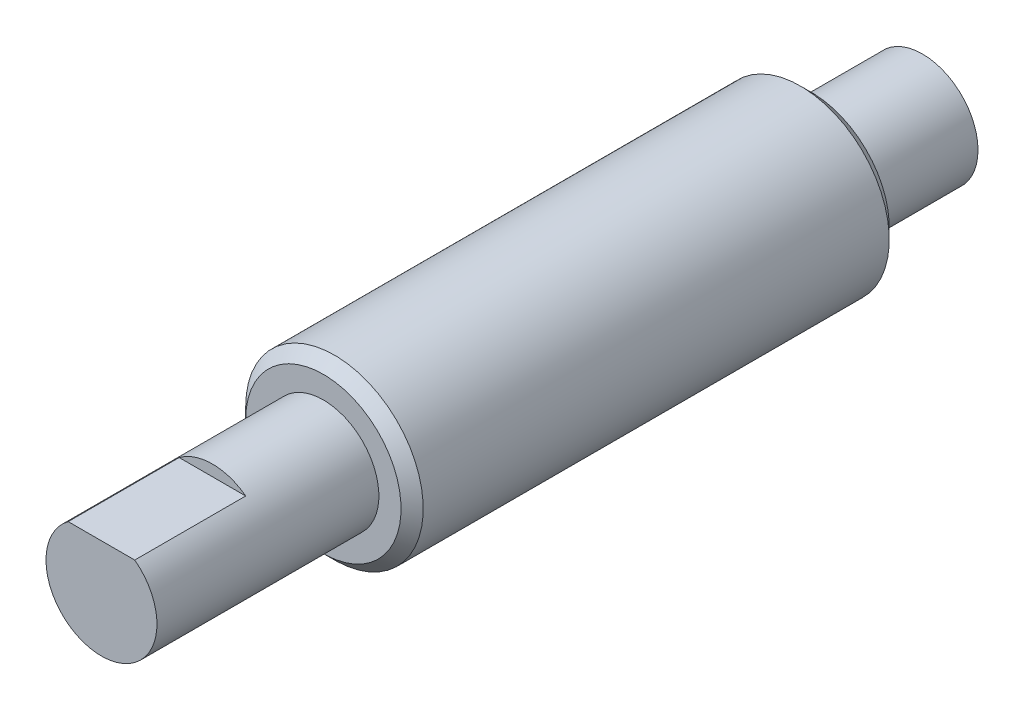
from build123d import *

# Parameters (mm, degrees)
CUT_EXTRUDE1_START = -10
CUT_EXTRUDE1_DEPTH = 10


with BuildPart() as part:
    # Sketch1 → Revolve1 (revolve)
    with BuildSketch(Plane(origin=(0, 0, 0), x_dir=(1, 0, 0), z_dir=(0, 1, 0)), mode=Mode.PRIVATE) as revolve1_sk:
        Polygon((0, 74), (0, 0), (5, 0), (5, 20), (7, 20), (8, 21), (8, 63), (7, 64), (5, 64), (5, 74), (0, 76.886751346), align=None)
    revolve(revolve1_sk.sketch.rotate(Axis((0, 0, -74), (0, 0, 1)), 180), axis=Axis((0, 0, -74), (0, 0, 1)))

    # Sketch2 → Cut-Extrude1 (cut)
    with BuildSketch(Plane.XY.offset(CUT_EXTRUDE1_START)):
        with BuildLine():
            Line((-3, 4), (3, 4))
            ThreePointArc((3, 4), (0, 5), (-3, 4))
        make_face()
    extrude(amount=CUT_EXTRUDE1_DEPTH, mode=Mode.SUBTRACT)


solid = part.part
